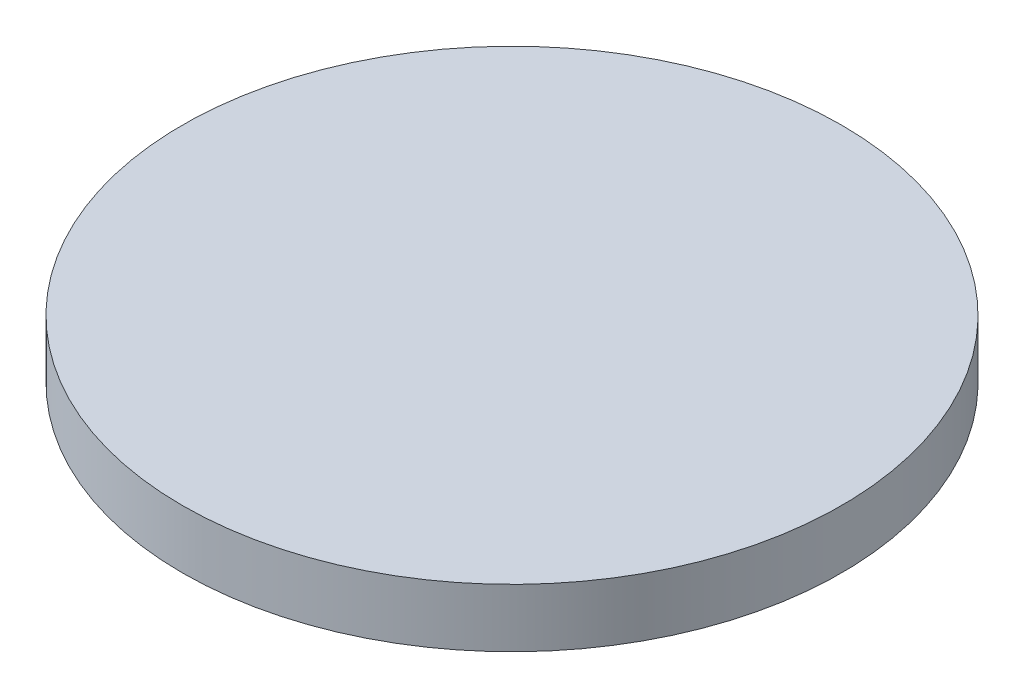
from build123d import *

# Parameters (mm, degrees)
SKETCH1_R           = 11.292
BOSS_EXTRUDE1_DEPTH = 2


with BuildPart() as part:
    # Sketch1 → Boss-Extrude1 (new body)
    with BuildSketch(Plane(origin=(0, 0, 0), x_dir=(1, 0, 0), z_dir=(0, 1, 0))):
        with Locations(Location((0, 0, 0), (0, 0, 270))):
            Circle(SKETCH1_R)
    extrude(amount=BOSS_EXTRUDE1_DEPTH)


solid = part.part
